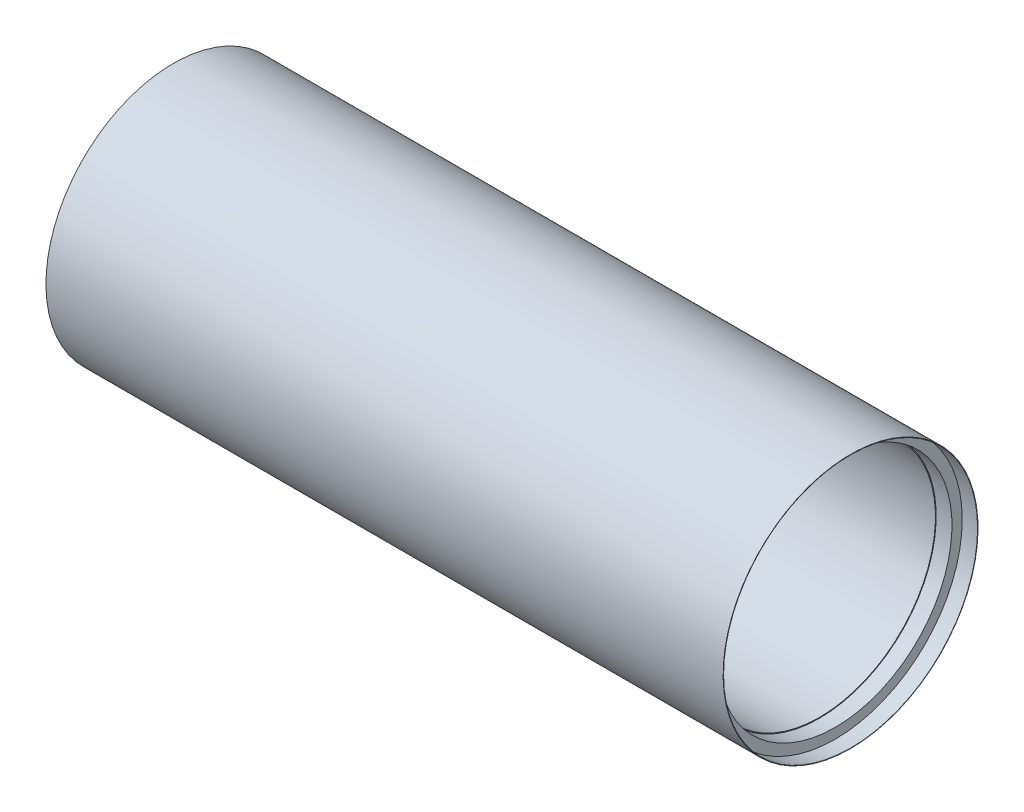
from build123d import *


with BuildPart() as part:
    # Sketch1 → Revolve1 (revolve)
    with BuildSketch(Plane.XY):
        Polygon((0, 84.3534), (0, 83.9724), (10.16, 83.9724), (10.16, 77.2414), (20.574, 77.2414), (20.574, 76.7334), (427.5582, 76.7334), (427.5582, 77.2414), (437.9722, 77.2414), (437.9722, 84.0486), (448.1322, 84.0486), (448.1322, 84.3534), align=None)
    revolve(axis=Axis((0, 0, 0), (1, 0, 0)))


solid = part.part
